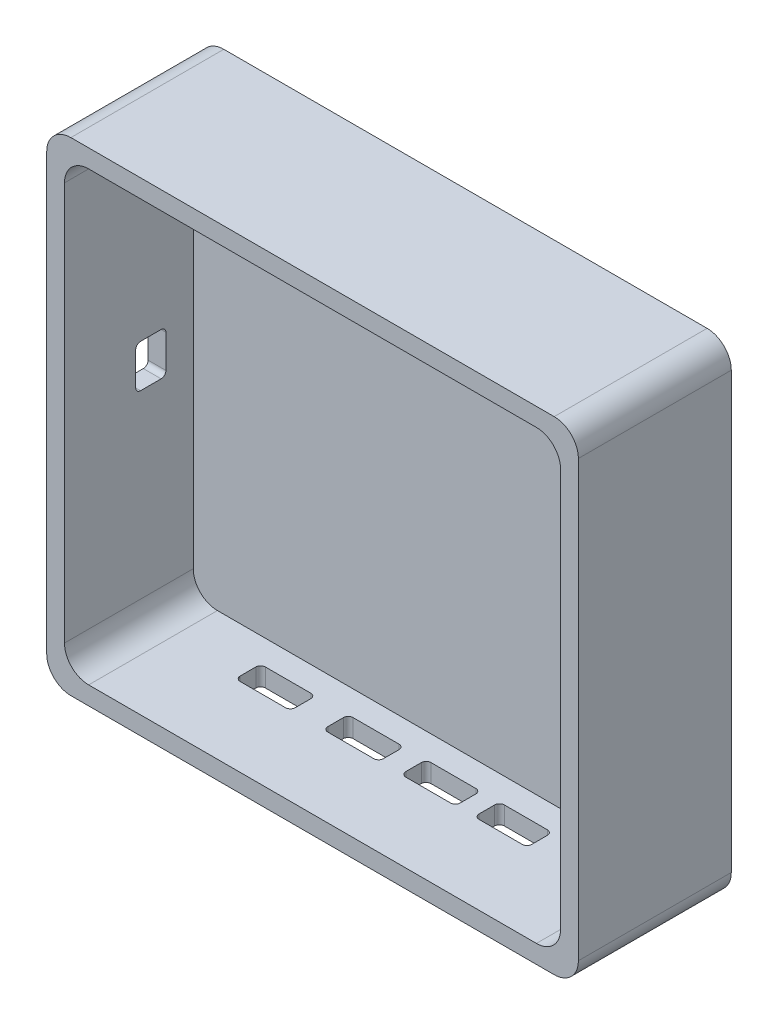
from build123d import *

# Parameters (mm, degrees)
ESQUISSE1_W             = 110
ESQUISSE1_H             = 100
BOSS_EXTRU_1_DEPTH      = 60
CONG_1_R                = 5
ESQUISSE2_W             = 102.640200382
ESQUISSE2_H             = 92.45985442
ENL_V_MAT_EXTRU_1_DEPTH = 55
CONG_2_R                = 5
ESQUISSE3_W             = 11.37967439
ESQUISSE3_H             = 5.215684095
ESQUISSE3_W_2           = 11.498212665
ESQUISSE3_W_3           = 11.261136116
ESQUISSE3_W_4           = 10.905521291
ENL_V_MAT_EXTRU_2_DEPTH = 55
CONG_3_R                = 1
ESQUISSE4_W             = 6.250199949
ESQUISSE4_H             = 8.836489583
ENL_V_MAT_EXTRU_3_DEPTH = 55
CONG_4_R                = 1
ESQUISSE6_W             = 129.088181363
ESQUISSE6_H             = 36.035635569
ENL_V_MAT_EXTRU_5_DEPTH = 115


with BuildPart() as part:
    # Esquisse1 → Boss.-Extru.1 (new body)
    with BuildSketch(Plane.XY):
        with Locations((-55, 50)):
            Rectangle(ESQUISSE1_W, ESQUISSE1_H)
    extrude(amount=BOSS_EXTRU_1_DEPTH)

    # Congé1
    cong_1_edges = [part.edges().sort_by_distance(p)[0] for p in [
        (0, 0, 30),
        (-110, 0, 30),
        (-110, 100, 30),
        (0, 100, 30),
    ]]
    fillet(cong_1_edges, radius=CONG_1_R)

    # Esquisse2 → Enlèv. mat.-Extru.1 (cut)
    with BuildSketch(Plane.XY.offset(60)):
        with Locations((-55, 50)):
            Rectangle(ESQUISSE2_W, ESQUISSE2_H)
    extrude(amount=-ENL_V_MAT_EXTRU_1_DEPTH, mode=Mode.SUBTRACT)

    # Congé2
    cong_2_edges = [part.edges().sort_by_distance(p)[0] for p in [
        (-106.320100191, 3.77007279, 32.5),
        (-106.320100191, 96.22992721, 32.5),
        (-3.679899809, 96.22992721, 32.5),
        (-3.679899809, 3.77007279, 32.5),
    ]]
    fillet(cong_2_edges, radius=CONG_2_R)

    # Esquisse3 → Enlèv. mat.-Extru.2 (cut)
    with BuildSketch(Plane.XZ):
        with Locations((-81.552573577, 12.752681003)):
            Rectangle(ESQUISSE3_W, ESQUISSE3_H)
        with Locations((-63.356948381, 12.752681003)):
            Rectangle(ESQUISSE3_W_2, ESQUISSE3_H)
        with Locations((-47.354281269, 12.752681003)):
            Rectangle(ESQUISSE3_W_3, ESQUISSE3_H)
        with Locations((-32.359189495, 12.752681003)):
            Rectangle(ESQUISSE3_W_4, ESQUISSE3_H)
    extrude(amount=-ENL_V_MAT_EXTRU_2_DEPTH, mode=Mode.SUBTRACT)

    # Congé3
    cong_3_edges = [part.edges().sort_by_distance(p)[0] for p in [
        (-69.106054713, 1.885036395, 10.144838955),
        (-69.106054713, 1.885036395, 15.36052305),
        (-57.607842048, 1.885036395, 15.36052305),
        (-57.607842048, 1.885036395, 10.144838955),
        (-52.984849327, 1.885036395, 10.144838955),
        (-52.984849327, 1.885036395, 15.36052305),
        (-41.723713211, 1.885036395, 15.36052305),
        (-41.723713211, 1.885036395, 10.144838955),
        (-37.81195014, 1.885036395, 10.144838955),
        (-37.81195014, 1.885036395, 15.36052305),
        (-26.906428849, 1.885036395, 15.36052305),
        (-26.906428849, 1.885036395, 10.144838955),
        (-87.242410772, 1.885036395, 10.144838955),
        (-87.242410772, 1.885036395, 15.36052305),
        (-75.862736382, 1.885036395, 15.36052305),
        (-75.862736382, 1.885036395, 10.144838955),
    ]]
    fillet(cong_3_edges, radius=CONG_3_R)

    # Esquisse4 → Enlèv. mat.-Extru.3 (cut)
    with BuildSketch(Plane.ZY.offset(110)):
        with Locations((13.781808753, 50.538810341)):
            Rectangle(ESQUISSE4_W, ESQUISSE4_H)
    extrude(amount=-ENL_V_MAT_EXTRU_3_DEPTH, mode=Mode.SUBTRACT)

    # Congé4
    cong_4_edges = [part.edges().sort_by_distance(p)[0] for p in [
        (-108.160050095, 46.120565549, 16.906908727),
        (-108.160050095, 46.120565549, 10.656708778),
        (-108.160050095, 54.957055132, 10.656708778),
        (-108.160050095, 54.957055132, 16.906908727),
    ]]
    fillet(cong_4_edges, radius=CONG_4_R)

    # Esquisse6 → Enlèv. mat.-Extru.5 (cut)
    with BuildSketch(Plane(origin=(0, 0, 0), x_dir=(1, 0, 0), z_dir=(0, 1, 0))):
        with Locations((-55.445822543, -49.658229713)):
            Rectangle(ESQUISSE6_W, ESQUISSE6_H)
    extrude(amount=ENL_V_MAT_EXTRU_5_DEPTH, mode=Mode.SUBTRACT)


solid = part.part
